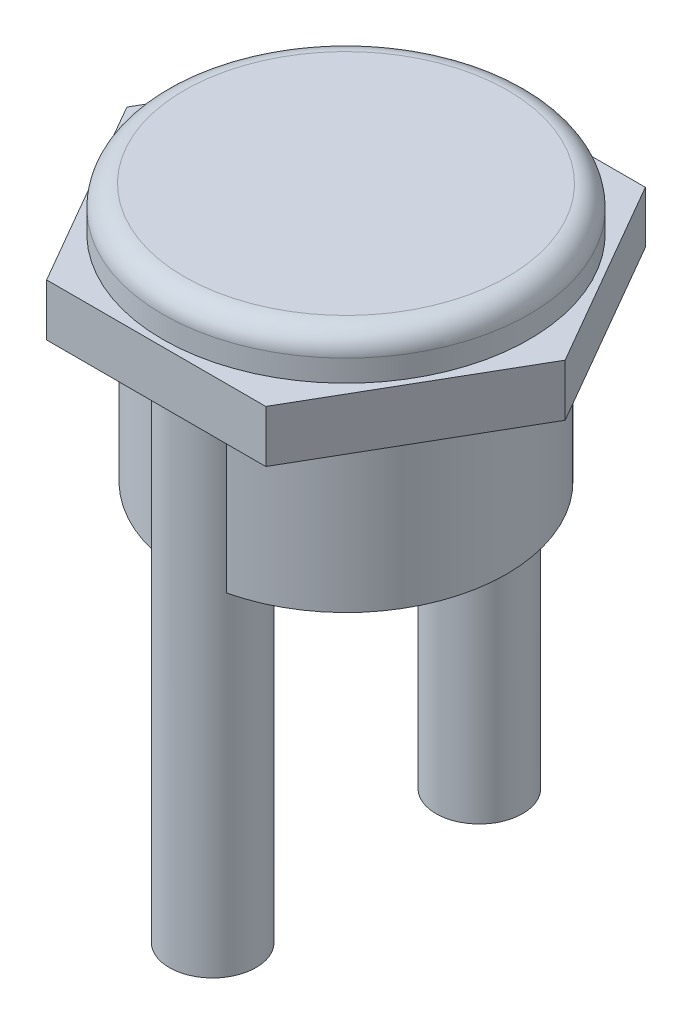
from build123d import *

# Parameters (mm, degrees)
SKETCH1_R           = 10.7315
BOSS_EXTRUDE1_DEPTH = 2.54
BOSS_EXTRUDE2_DEPTH = 3.048
SKETCH4_R           = 9.398
BOSS_EXTRUDE4_DEPTH = 9.525
SKETCH3_R           = 2.54
BOSS_EXTRUDE3_DEPTH = 29
FILLET1_R           = 1.27


with BuildPart() as part:
    # Sketch1 → Boss-Extrude1 (new body)
    with BuildSketch(Plane(origin=(0, 0, 0), x_dir=(1, 0, 0), z_dir=(0, 1, 0))):
        with Locations(Location((0, 0, 0), (0, 0, 270))):
            Circle(SKETCH1_R)
    extrude(amount=BOSS_EXTRUDE1_DEPTH)

    # Sketch2 → Boss-Extrude2 (add)
    with BuildSketch(Plane.XZ):
        Polygon((-12.831609733, 0), (-6.415804866, -11.1125), (6.415804866, -11.1125), (12.831609733, 0), (6.415804866, 11.1125), (-6.415804866, 11.1125), align=None)
    extrude(amount=BOSS_EXTRUDE2_DEPTH)

    # Sketch4 → Boss-Extrude4 (add)
    with BuildSketch(Plane.XZ.offset(3.048)):
        with Locations(Location((0, 0, 0), (0, 0, 90))):
            Circle(SKETCH4_R)
    extrude(amount=BOSS_EXTRUDE4_DEPTH)

    # Sketch3 → Boss-Extrude3 (add)
    with BuildSketch(Plane.XZ.offset(3.048)):
        with Locations(Location((0, 7.80660503, 0), (0, 0, 31.85091732))):
            Circle(SKETCH3_R)
        with Locations(Location((0, -7.80660503, 0), (0, 0, 211.85091732))):
            Circle(SKETCH3_R)
    extrude(amount=BOSS_EXTRUDE3_DEPTH)

    # Fillet1
    fillet1_edges = [part.edges().sort_by_distance(p)[0] for p in [
        (0, 2.54, -10.7315),
    ]]
    fillet(fillet1_edges, radius=FILLET1_R)


solid = part.part
